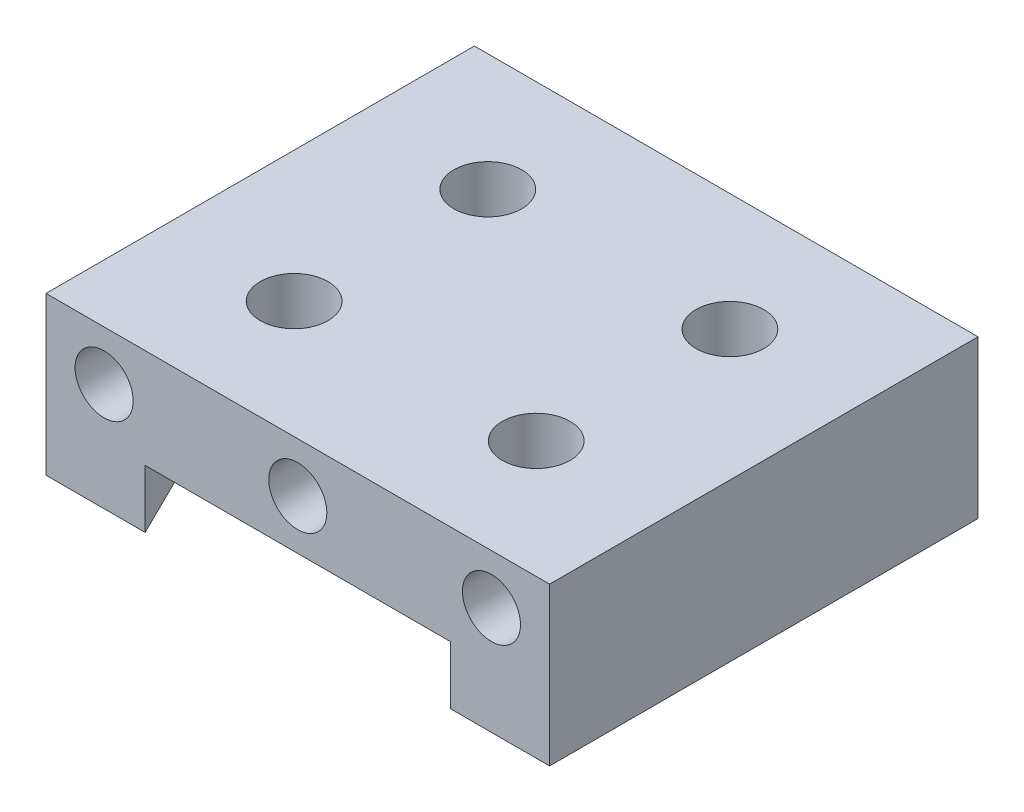
from build123d import *

# Parameters (mm, degrees)
SKETCH1_W           = 26
SKETCH1_H           = 22.12
SKETCH1_R           = 1.75
BOSS_EXTRUDE1_DEPTH = 5.13
CUT_EXTRUDE1_REACH  = 28.165
SKETCH2_R           = 1.5
BOSS_EXTRUDE2_DEPTH = 3


with BuildPart() as part:
    # Sketch1 → Boss-Extrude1 (new body)
    with BuildSketch(Plane(origin=(0, 0, 0), x_dir=(1, 0, 0), z_dir=(0, 1, 0))):
        Rectangle(SKETCH1_W, SKETCH1_H)
        with Locations((-6.25, -5)):
            Circle(SKETCH1_R, mode=Mode.SUBTRACT)
        with Locations((6.25, -5)):
            Circle(SKETCH1_R, mode=Mode.SUBTRACT)
        with Locations((-6.25, 5)):
            Circle(SKETCH1_R, mode=Mode.SUBTRACT)
        with Locations((6.25, 5)):
            Circle(SKETCH1_R, mode=Mode.SUBTRACT)
    extrude(amount=BOSS_EXTRUDE1_DEPTH)

    # Sketch2 → Cut-Extrude1 (cut, up to next)
    with BuildSketch(Plane.XY.offset(11.06), mode=Mode.PRIVATE) as cut_extrude1_sk1:
        with Locations((0, 2.565)):
            Circle(SKETCH2_R)
    cut_extrude1_tool1 = extrude(cut_extrude1_sk1.sketch, amount=-CUT_EXTRUDE1_REACH, mode=Mode.PRIVATE) & part.part
    # Sketch2 → Cut-Extrude1 (cut, up to next)
    with BuildSketch(Plane.XY.offset(11.06), mode=Mode.PRIVATE) as cut_extrude1_sk2:
        with Locations((-10, 2.565)):
            Circle(SKETCH2_R)
    cut_extrude1_tool2 = extrude(cut_extrude1_sk2.sketch, amount=-CUT_EXTRUDE1_REACH, mode=Mode.PRIVATE) & part.part
    # Sketch2 → Cut-Extrude1 (cut, up to next)
    with BuildSketch(Plane.XY.offset(11.06), mode=Mode.PRIVATE) as cut_extrude1_sk3:
        with Locations((10, 2.565)):
            Circle(SKETCH2_R)
    cut_extrude1_tool3 = extrude(cut_extrude1_sk3.sketch, amount=-CUT_EXTRUDE1_REACH, mode=Mode.PRIVATE) & part.part
    add(cut_extrude1_tool1.solids().sort_by_distance((0, 2.565, 11.06))[0], mode=Mode.SUBTRACT)
    add(cut_extrude1_tool2.solids().sort_by_distance((-10, 2.565, 11.06))[0], mode=Mode.SUBTRACT)
    add(cut_extrude1_tool3.solids().sort_by_distance((10, 2.565, 11.06))[0], mode=Mode.SUBTRACT)

    # Sketch3 → Boss-Extrude2 (add)
    with BuildSketch(Plane.XZ):
        with BuildLine():
            Line((-13, -11.06), (-11.035, -11.06))
            Line((-11.035, -11.06), (-11.63, 2.57))
            add(Edge.make_bspline(
                [(-11.63, 2.57), (-11.34945273, 3.758467492), (-10.92, 4.9)],
                knots=[0, 0, 0, 1, 1, 1], degree=2))
            Line((-10.92, 4.9), (-7.881497006, 11.06))
            Line((-7.881497006, 11.06), (-13, 11.06))
            Line((-13, 11.06), (-13, -11.06))
        make_face()
        with BuildLine():
            Line((11.63, 2.57), (11.035, -11.06))
            Line((11.035, -11.06), (13, -11.06))
            Line((13, -11.06), (13, 11.06))
            Line((13, 11.06), (7.881497006, 11.06))
            Line((7.881497006, 11.06), (10.92, 4.9))
            add(Edge.make_bspline(
                [(11.63, 2.57), (11.34945273, 3.758467492), (10.92, 4.9)],
                knots=[0, 0, 0, 1, 1, 1], degree=2))
        make_face()
    extrude(amount=BOSS_EXTRUDE2_DEPTH)


solid = part.part
